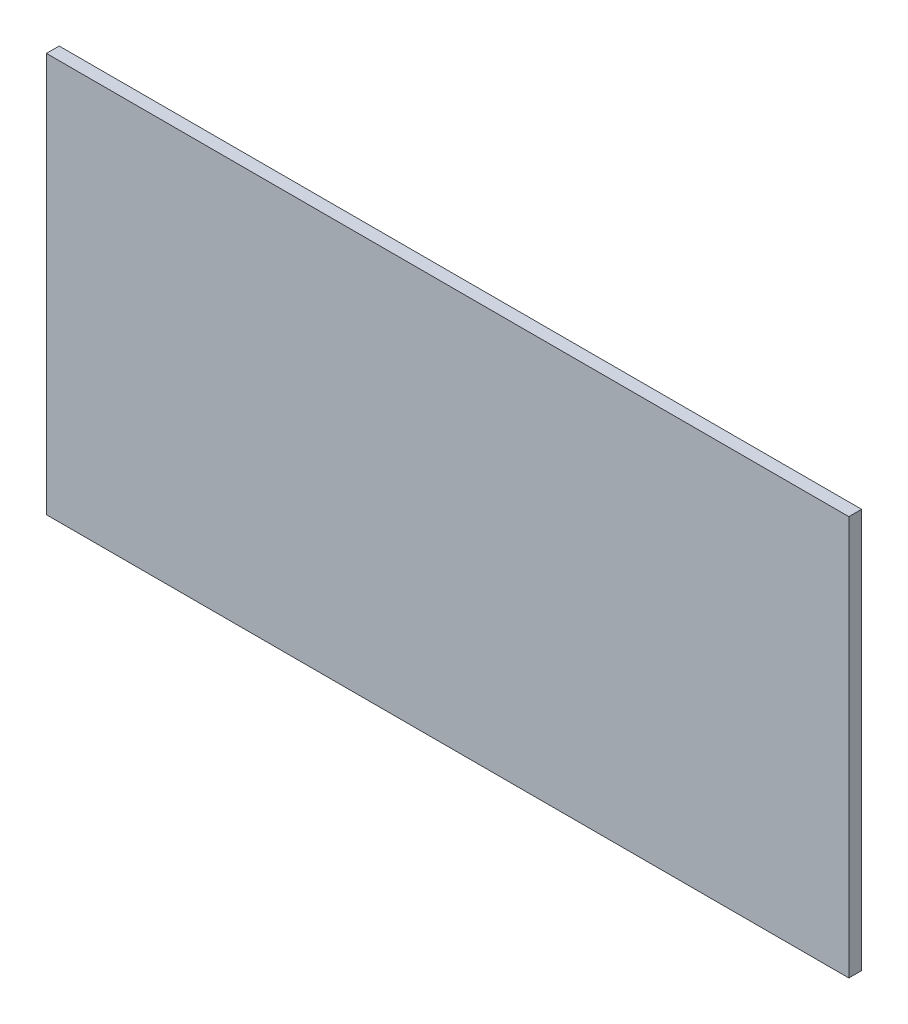
from build123d import *

# Parameters (mm, degrees)
SKETCH1_W           = 1147.7625
SKETCH1_H           = 571.5
BOSS_EXTRUDE1_DEPTH = 18.25625


with BuildPart() as part:
    # Sketch1 → Boss-Extrude1 (new body)
    with BuildSketch(Plane.XY):
        Rectangle(SKETCH1_W, SKETCH1_H)
    extrude(amount=BOSS_EXTRUDE1_DEPTH)


solid = part.part
